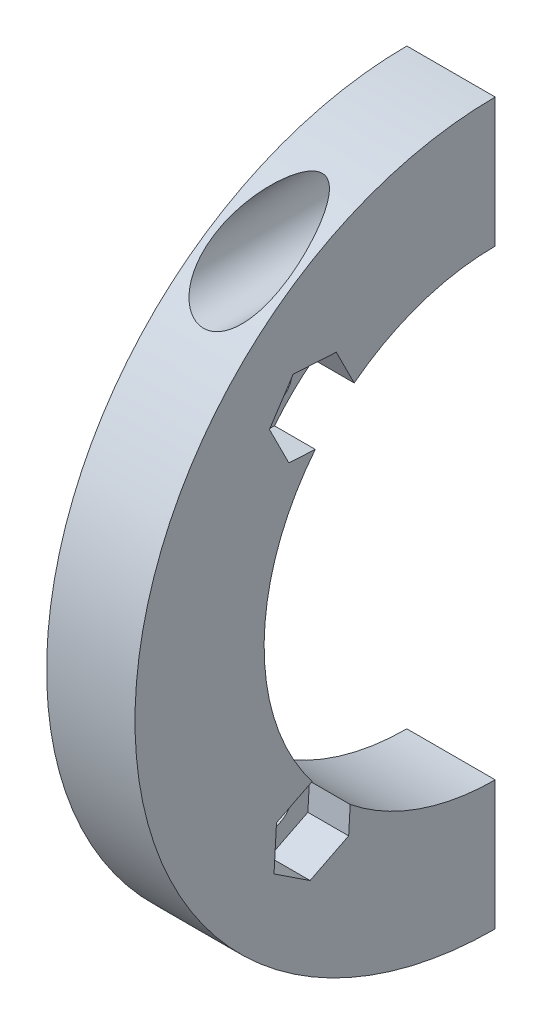
from build123d import *

# Parameters (mm, degrees)
BOSS_EXTRUDE1_DEPTH      = 3.25
BOSS_EXTRUDE1_DEPTH_BACK = 3.25
SKETCH1_R                = 1.5
SKETCH3_R                = 1.5
CUT_EXTRUDE1_DEPTH       = 25.5
SKETCH4_R                = 2.75
CUT_EXTRUDE2_DEPTH       = 25
CUT_EXTRUDE3_DEPTH       = 25
CUT_EXTRUDE4_DEPTH       = 3


with BuildPart() as part:
    # Sketch1 → Boss-Extrude1 (new, two sides: drawn at the far end of the back side and taken through both)
    with BuildSketch(Plane(origin=(0, 0, 0), x_dir=(0, 0, -1), z_dir=(1, 0, 0)).offset(-BOSS_EXTRUDE1_DEPTH_BACK)):
        with BuildLine():
            Line((0, 17), (0, 26.5))
            ThreePointArc((0, 26.5), (-26.5, 0), (0, -26.5))
            Line((0, -26.5), (0, -17))
            ThreePointArc((0, -17), (-15.705952053, -6.50561835), (-12.02081528, 12.02081528))
            ThreePointArc((-12.02081528, 12.02081528), (-6.50561835, 15.705952053), (0, 17))
        make_face()
        with Locations((-13.435028843, -13.435028843)):
            Circle(SKETCH1_R, mode=Mode.SUBTRACT)
        with BuildLine():
            ThreePointArc((-11.935028843, 13.435028843), (-12.049209544, 12.861003694), (-12.374368671, 12.374368671))
            ThreePointArc((-12.374368671, 12.374368671), (-14.820848141, 14.009053991), (-11.935028843, 13.435028843))
        make_face(mode=Mode.SUBTRACT)
    extrude(amount=BOSS_EXTRUDE1_DEPTH + BOSS_EXTRUDE1_DEPTH_BACK)

    # Sketch3 → Cut-Extrude1 (cut)
    with BuildSketch(Plane(origin=(0, 0, 0), x_dir=(-1, 0, 0), z_dir=(0, 0, -1))):
        with Locations((0, 22)):
            Circle(SKETCH3_R)
    cut_extrude1 = extrude(amount=-CUT_EXTRUDE1_DEPTH, mode=Mode.SUBTRACT)

    # Mirror1: Cut-Extrude1 across plane
    add(cut_extrude1.mirror(Plane.ZX), mode=Mode.SUBTRACT)

    # Sketch4 → Cut-Extrude2 (cut)
    with BuildSketch(Plane(origin=(0, 0, 30), x_dir=(-1, 0, 0), z_dir=(0, 0, -1))):
        with Locations((0, 22)):
            Circle(SKETCH4_R)
    extrude(amount=CUT_EXTRUDE2_DEPTH, mode=Mode.SUBTRACT)

    # Sketch5 → Cut-Extrude3 (cut)
    with BuildSketch(Plane(origin=(0, 0, 30), x_dir=(-1, 0, 0), z_dir=(0, 0, -1))):
        Polygon((2.75, -23.58771324), (2.75, -20.41228676), (0, -18.824573519), (-2.75, -20.41228676), (-2.75, -23.58771324), (0, -25.175426481), align=None)
    extrude(amount=CUT_EXTRUDE3_DEPTH, mode=Mode.SUBTRACT)

    # Sketch6 → Cut-Extrude4 (cut)
    with BuildSketch(Plane(origin=(3.25, 0, 0), x_dir=(0, 0, -1), z_dir=(1, 0, 0))):
        Polygon((-16.088258489, -11.690406885), (-16.272530601, -14.86048214), (-13.619300954, -16.605104098), (-10.781799196, -15.1796508), (-10.597527084, -12.009575545), (-13.250756731, -10.264953588), align=None)
        Polygon((-11.690406885, 16.088258489), (-14.86048214, 16.272530601), (-16.605104098, 13.619300954), (-15.1796508, 10.781799196), (-12.009575545, 10.597527084), (-10.264953588, 13.250756731), align=None)
        Polygon((11.690406885, -16.088258489), (14.86048214, -16.272530601), (16.605104098, -13.619300954), (15.1796508, -10.781799196), (12.009575545, -10.597527084), (10.264953588, -13.250756731), align=None)
        Polygon((16.088258489, 11.690406885), (16.272530601, 14.86048214), (13.619300954, 16.605104098), (10.781799196, 15.1796508), (10.597527084, 12.009575545), (13.250756731, 10.264953588), align=None)
    extrude(amount=-CUT_EXTRUDE4_DEPTH, mode=Mode.SUBTRACT)


solid = part.part
